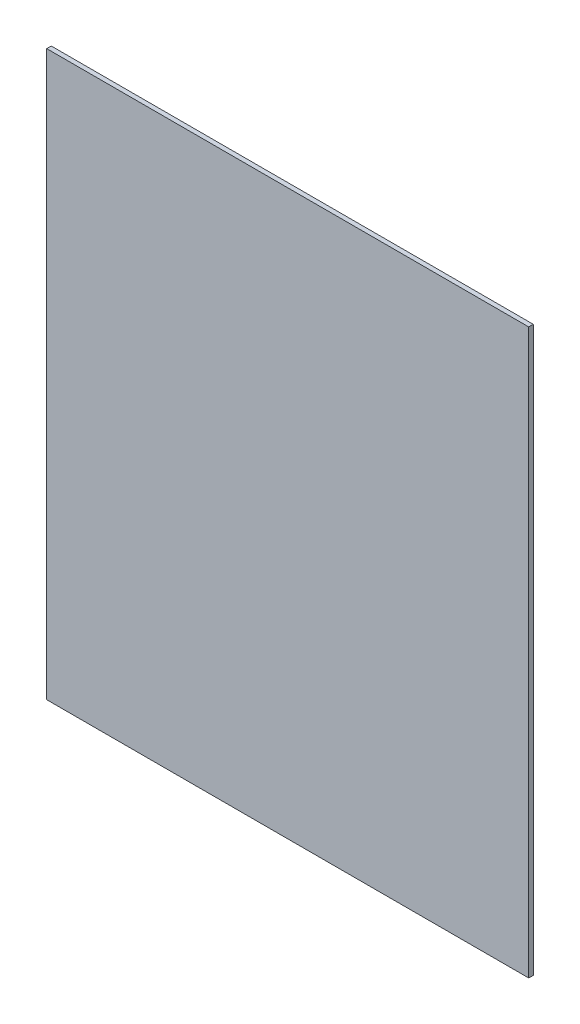
from build123d import *

# Parameters (mm, degrees)
ESQUISSE1_W        = 530
ESQUISSE1_H        = 620
BOSS_EXTRU_1_DEPTH = 5


with BuildPart() as part:
    # Esquisse1 → Boss.-Extru.1 (new body)
    with BuildSketch(Plane.XY):
        Rectangle(ESQUISSE1_W, ESQUISSE1_H)
    extrude(amount=BOSS_EXTRU_1_DEPTH)


solid = part.part
